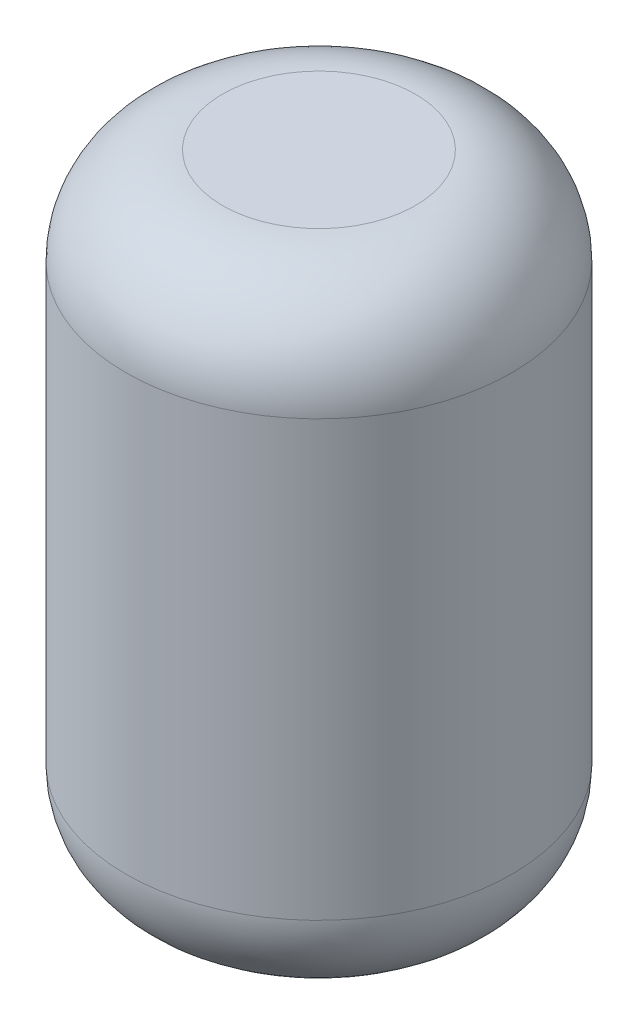
from build123d import *

# Parameters (mm, degrees)
SKETCH1_R           = 50.8
BOSS_EXTRUDE1_DEPTH = 165.1
FILLET1_R           = 25.4
FILLET2_R           = 25.4


with BuildPart() as part:
    # Sketch1 → Boss-Extrude1 (new body)
    with BuildSketch(Plane(origin=(0, 0, 0), x_dir=(1, 0, 0), z_dir=(0, 1, 0))):
        with Locations(Location((0, 0, 0), (0, 0, 270))):
            Circle(SKETCH1_R)
    extrude(amount=BOSS_EXTRUDE1_DEPTH)

    # Fillet1
    fillet1_edges = [part.edges().sort_by_distance(p)[0] for p in [
        (0, 165.1, -50.8),
    ]]
    fillet(fillet1_edges, radius=FILLET1_R)

    # Fillet2
    fillet2_edges = [part.edges().sort_by_distance(p)[0] for p in [
        (0, 0, -50.8),
    ]]
    fillet(fillet2_edges, radius=FILLET2_R)


solid = part.part
